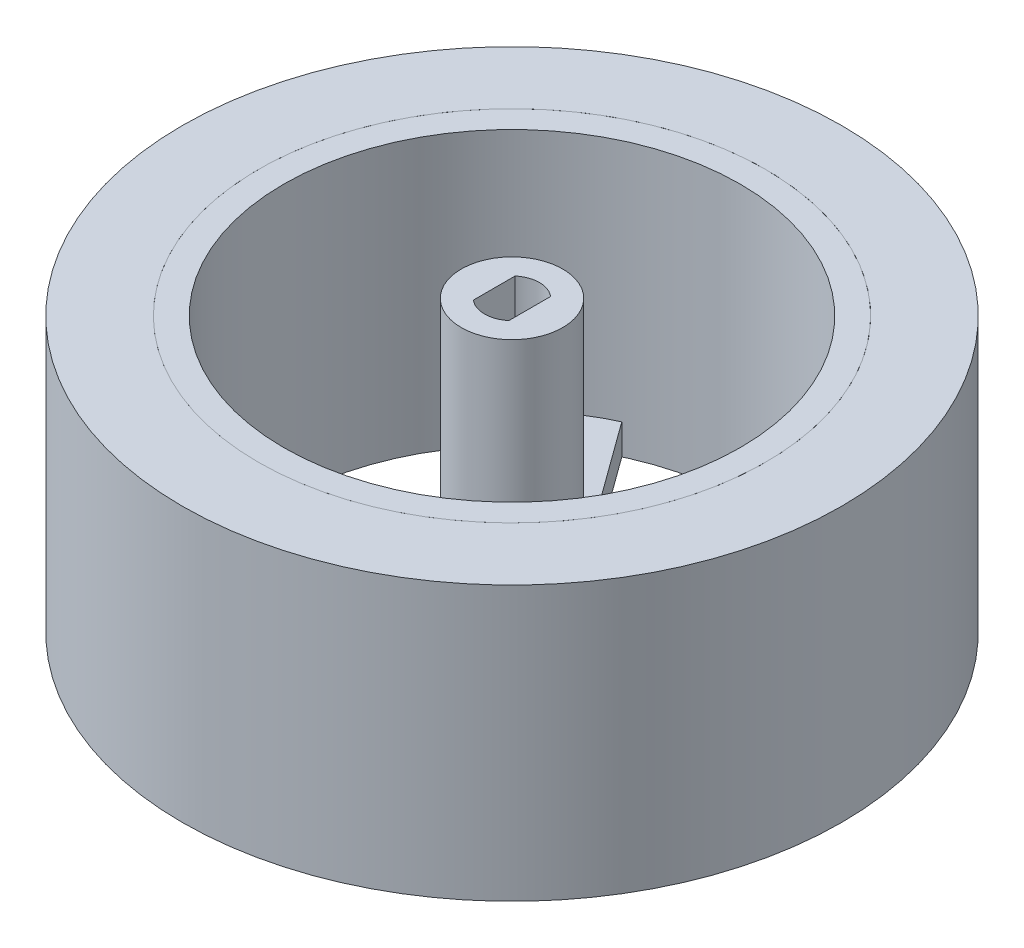
from build123d import *

# Parameters (mm, degrees)
SKETCH1_R           = 32.5
SKETCH1_R_2         = 25
BOSS_EXTRUDE1_DEPTH = 27
SKETCH2_R           = 25
SKETCH2_R_2         = 22.5
BOSS_EXTRUDE2_DEPTH = 27
BOSS_EXTRUDE3_DEPTH = 3
SKETCH4_R           = 0.75
CUT_EXTRUDE1_DEPTH  = 3
SKETCH5_R           = 5
BOSS_EXTRUDE4_DEPTH = 25.5


with BuildPart() as part:
    # Sketch1 → Boss-Extrude1 (new body)
    with BuildSketch(Plane(origin=(0, 0, 0), x_dir=(1, 0, 0), z_dir=(0, 1, 0))):
        with Locations(Location((0, 0, 0), (0, 0, 270))):
            Circle(SKETCH1_R)
        with Locations(Location((0, 0, 0), (0, 0, 270))):
            Circle(SKETCH1_R_2, mode=Mode.SUBTRACT)
    extrude(amount=BOSS_EXTRUDE1_DEPTH)


with BuildPart() as body_2:
    # Sketch2 → Boss-Extrude2 (new body)
    with BuildSketch(Plane.XZ):
        with Locations(Location((0, 0, 0), (0, 0, 270))):
            Circle(SKETCH2_R)
        with Locations(Location((0, 0, 0), (0, 0, 270))):
            Circle(SKETCH2_R_2, mode=Mode.SUBTRACT)
    extrude(amount=-BOSS_EXTRUDE2_DEPTH)


with BuildPart() as body_3:
    # Sketch3 → Boss-Extrude3 (new body)
    with BuildSketch(Plane.XZ):
        with BuildLine():
            Line((4.25, 8.036806053), (6.330134541, 6.525499845))
            Line((6.330134541, 6.525499845), (19.70023868, 10.869710021))
            ThreePointArc((19.70023868, 10.869710021), (20.438539496, 9.408299702), (21.068609586, 7.897068451))
            Line((21.068609586, 7.897068451), (8.250491652, 3.732209466))
            Line((8.250491652, 3.732209466), (8.868525641, 1.830096433))
            Line((8.868525641, 1.830096433), (21.686643575, 5.994955418))
            ThreePointArc((21.686643575, 5.994955418), (22.065185606, 4.401997747), (22.326883133, 2.785729632))
            Line((22.326883133, 2.785729632), (8.956778993, -1.558480543))
            Line((8.956778993, -1.558480543), (8.1622383, -4.003825356))
            Line((8.1622383, -4.003825356), (16.425417091, -15.377115249))
            ThreePointArc((16.425417091, -15.377115249), (15.263680783, -16.530881675), (14.02111682, -17.597110079))
            Line((14.02111682, -17.597110079), (6.099084265, -6.693367697))
            Line((6.099084265, -6.693367697), (4.481050276, -7.868938202))
            Line((4.481050276, -7.868938202), (12.403082831, -18.772680583))
            ThreePointArc((12.403082831, -18.772680583), (11.005065978, -19.624946441), (9.548772639, -20.373289894))
            Line((9.548772639, -20.373289894), (1.285593848, -9))
            Line((1.285593848, -9), (-1.285593848, -9))
            Line((-1.285593848, -9), (-9.548772639, -20.373289894))
            ThreePointArc((-9.548772639, -20.373289894), (-11.005065978, -19.624946441), (-12.403082831, -18.772680583))
            Line((-12.403082831, -18.772680583), (-4.481050276, -7.868938202))
            Line((-4.481050276, -7.868938202), (-6.099084265, -6.693367697))
            Line((-6.099084265, -6.693367697), (-14.02111682, -17.597110079))
            ThreePointArc((-14.02111682, -17.597110079), (-15.263680783, -16.530881675), (-16.425417091, -15.377115249))
            Line((-16.425417091, -15.377115249), (-8.1622383, -4.003825356))
            Line((-8.1622383, -4.003825356), (-8.956778993, -1.558480543))
            Line((-8.956778993, -1.558480543), (-22.326883133, 2.785729632))
            ThreePointArc((-22.326883133, 2.785729632), (-22.065185606, 4.401997747), (-21.686643575, 5.994955418))
            Line((-21.686643575, 5.994955418), (-8.868525641, 1.830096433))
            Line((-8.868525641, 1.830096433), (-8.250491652, 3.732209466))
            Line((-8.250491652, 3.732209466), (-21.068609586, 7.897068451))
            ThreePointArc((-21.068609586, 7.897068451), (-20.438539496, 9.408299702), (-19.70023868, 10.869710021))
            Line((-19.70023868, 10.869710021), (-6.330134541, 6.525499845))
            Line((-6.330134541, 6.525499845), (-4.25, 8.036806053))
            Line((-4.25, 8.036806053), (-4.25, 22.09496549))
            ThreePointArc((-4.25, 22.09496549), (-2.631968695, 22.345530667), (-1, 22.477766793))
            Line((-1, 22.477766793), (-1, 9))
            Line((-1, 9), (1, 9))
            Line((1, 9), (1, 22.477766793))
            ThreePointArc((1, 22.477766793), (2.631968695, 22.345530667), (4.25, 22.09496549))
            Line((4.25, 22.09496549), (4.25, 8.036806053))
        make_face()
    extrude(amount=-BOSS_EXTRUDE3_DEPTH)

    # Sketch4 → Cut-Extrude1 (cut)
    with BuildSketch(Plane.XZ):
        with Locations(Location((0, 0, 0), (0, 0, 270))):
            Circle(SKETCH4_R)
    extrude(amount=-CUT_EXTRUDE1_DEPTH, mode=Mode.SUBTRACT)


with BuildPart() as body_4:
    # Sketch5 → Boss-Extrude4 (new body)
    with BuildSketch(Plane(origin=(0, 3, 0), x_dir=(1, 0, 0), z_dir=(0, 1, 0))):
        with Locations(Location((0, 0, 0), (0, 0, 270))):
            Circle(SKETCH5_R)
        with BuildLine():
            Line((1.75, 2.056088519), (1.75, -2.056088519))
            ThreePointArc((1.75, -2.056088519), (0, -2.7), (-1.75, -2.056088519))
            Line((-1.75, -2.056088519), (-1.75, 2.056088519))
            ThreePointArc((-1.75, 2.056088519), (0, 2.7), (1.75, 2.056088519))
        make_face(mode=Mode.SUBTRACT)
    extrude(amount=BOSS_EXTRUDE4_DEPTH)


solid = Compound([part.part, body_2.part, body_3.part, body_4.part])
